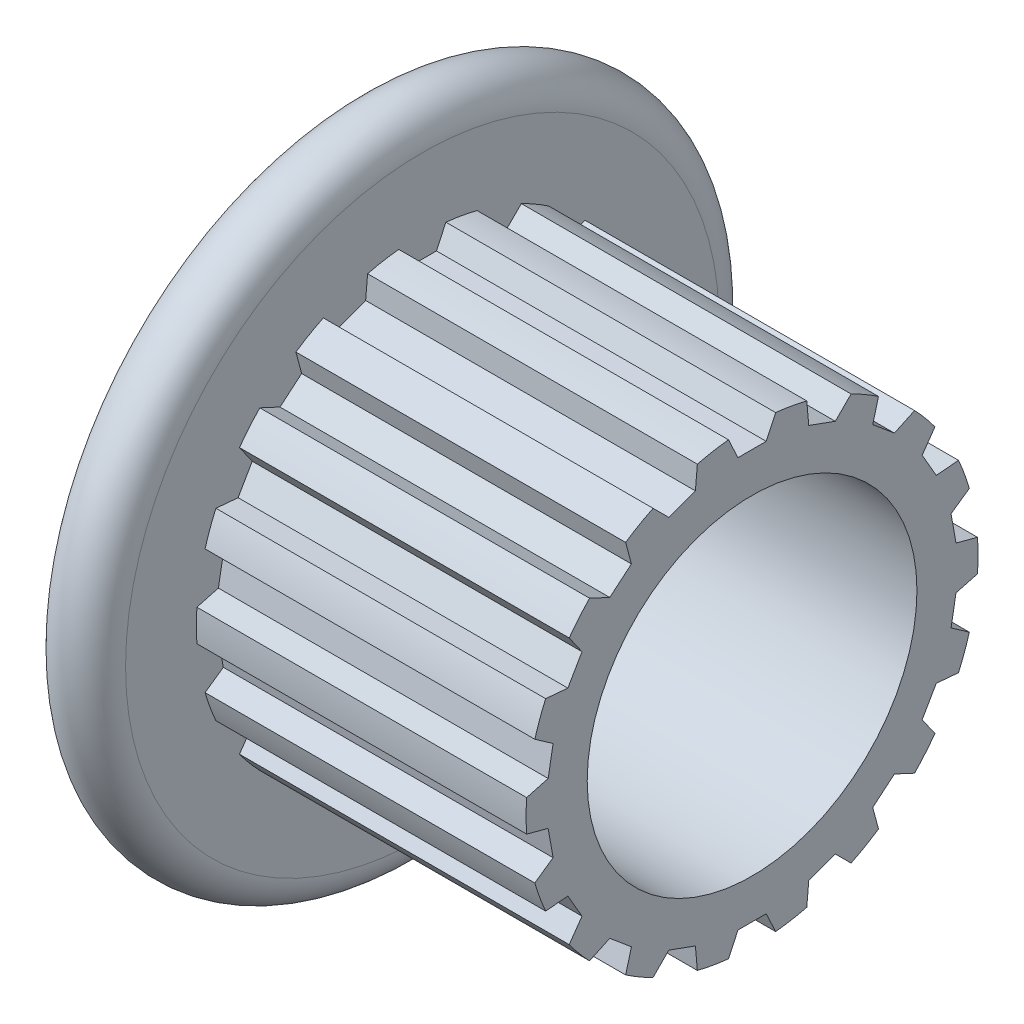
from build123d import *

# Parameters (mm, degrees)
SKETCH4_R          = 5.8
SKETCH4_R_2        = 5.4825
CUT_EXTRUDE2_DEPTH = 8
CUT_EXTRUDE1_DEPTH = 8
CIRPATTERN1_COUNT  = 18


with BuildPart() as part:
    # Sketch1 → Revolve1 (revolve)
    with BuildSketch(Plane.XY, mode=Mode.PRIVATE) as revolve1_sk:
        with BuildLine():
            Line((-1.6, 4), (8, 4))
            Line((8, 4), (8, 5.55))
            Line((8, 5.55), (0, 5.55))
            Line((0, 5.55), (0, 7.2))
            ThreePointArc((0, 7.2), (-0.8, 8), (-1.6, 7.2))
            Line((-1.6, 7.2), (-1.6, 4))
        make_face()
    revolve(revolve1_sk.sketch.rotate(Axis((-1.6, 0, 0), (1, 0, 0)), 90), axis=Axis((-1.6, 0, 0), (1, 0, 0)))

    # Sketch4 → Cut-Extrude2 (cut)
    with BuildSketch(Plane(origin=(0, 0, 0), x_dir=(0, 0, -1), z_dir=(1, 0, 0))):
        Circle(SKETCH4_R)
        with Locations(Location((0, 0, 0), (0, 0, 180))):
            Circle(SKETCH4_R_2, mode=Mode.SUBTRACT)
    extrude(amount=CUT_EXTRUDE2_DEPTH, mode=Mode.SUBTRACT)

    # Sketch3 → Cut-Extrude1 (cut)
    with BuildSketch(Plane(origin=(0, 0, 0), x_dir=(0, 0, -1), z_dir=(1, 0, 0))):
        with BuildLine():
            Line((-0.642345316, 5.604560113), (-0.343021997, 4.962659182))
            Line((-0.343021997, 4.962659182), (0.343021997, 4.962659182))
            Line((0.343021997, 4.962659182), (0.642345316, 5.604560113))
            ThreePointArc((0.642345316, 5.604560113), (0, 5.64125), (-0.642345316, 5.604560113))
        make_face()
    cut_extrude1 = extrude(amount=CUT_EXTRUDE1_DEPTH, mode=Mode.SUBTRACT)

    # CirPattern1: Cut-Extrude1 ×18 about axis
    cirpattern1_axis = Axis((0, 0, 0), (1, 0, 0))
    for i in range(1, CIRPATTERN1_COUNT):
        add(cut_extrude1.rotate(cirpattern1_axis, i * 360 / CIRPATTERN1_COUNT), mode=Mode.SUBTRACT)


solid = part.part
